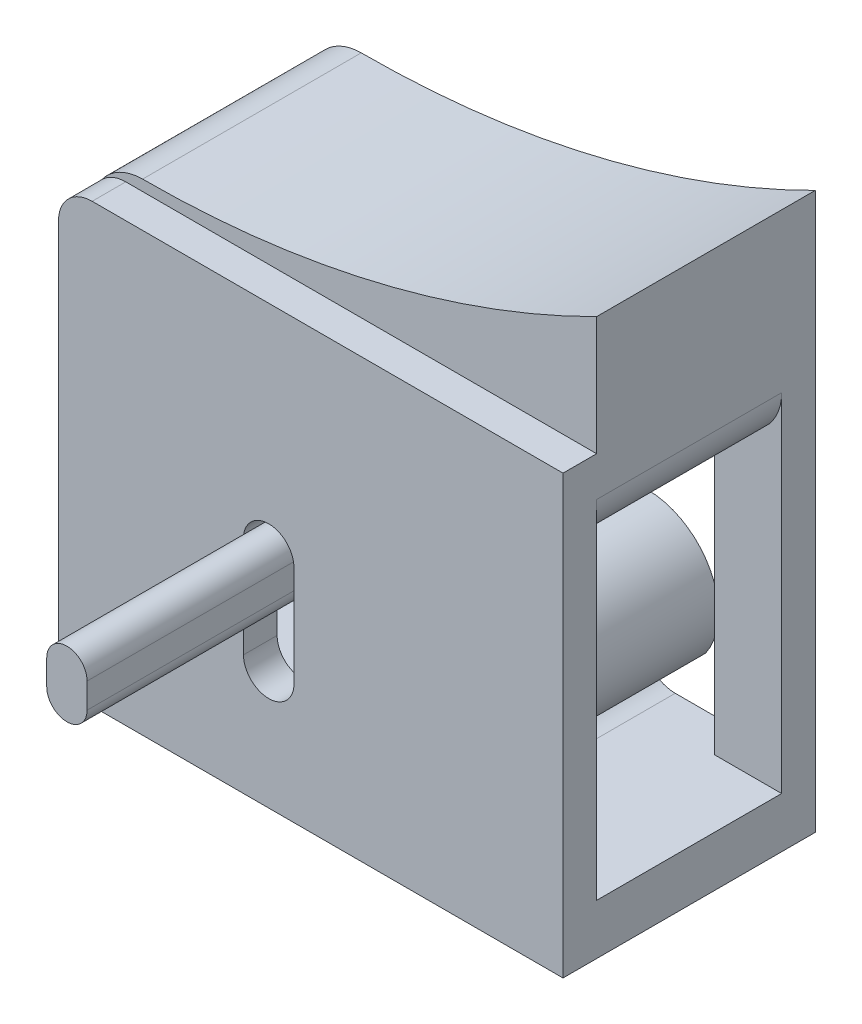
from build123d import *

# Parameters (mm, degrees)
RESSALTO_EXTRUS_O1_DEPTH   = 6
RESSALTO_EXTRUS_O1_2_DEPTH = 6
RESSALTO_EXTRUS_O2_START   = 1
RESSALTO_EXTRUS_O2_DEPTH   = 2
RESSALTO_EXTRUS_O4_START   = 1
ESBO_O3_W                  = 30
ESBO_O3_H                  = 3
RESSALTO_EXTRUS_O4_DEPTH   = 1
ESBO_O5_W                  = 4
ESBO_O5_H                  = 26
RESSALTO_EXTRUS_O6_DEPTH   = 2
RESSALTO_EXTRUS_O7_DEPTH   = 15
FILETE7_R                  = 2
FILETE8_R                  = 0.5
FILETE9_R                  = 2


with BuildPart() as part:
    # Esboço1 → Ressalto-extrusão1 (new, symmetric)
    with BuildSketch(Plane.XY):
        with BuildLine():
            Line((-9, -1.5), (9, -1.5))
            ThreePointArc((9, -1.5), (12, -4.5), (15, -1.5))
            Line((15, -1.5), (15, 1.5))
            Line((15, 1.5), (15, 7.918286702))
            ThreePointArc((15, 7.918286702), (1.876188275, 3.126620802), (-12, 1.5))
            ThreePointArc((-12, 1.5), (-14.121320344, 0.621320344), (-15, -1.5))
            ThreePointArc((-15, -1.5), (-12, -4.5), (-9, -1.5))
        make_face()
    extrude(amount=RESSALTO_EXTRUS_O1_DEPTH, both=True)



with BuildPart() as body_2:
    # Esboço1 → Ressalto-extrus_o1 2 (new, symmetric)
    with BuildSketch(Plane.XY):
        with BuildLine():
            Line((15, -25.142315596), (-15, -25.142315596))
            Line((-15, -25.142315596), (-15, -22.142315596))
            Line((-15, -22.142315596), (-3.5, -22.142315596))
            Line((-3.5, -22.142315596), (3.174548445, -22.142315596))
            Line((3.174548445, -22.142315596), (3.174548445, -16.732050808))
            Line((3.174548445, -16.732050808), (4.242268465, -16.732050808))
            ThreePointArc((4.242268465, -16.732050808), (5.462746803, -19.00323777), (7.90754076, -18.184189481))
            ThreePointArc((7.90754076, -18.184189481), (5.745986772, -13.568824016), (1.75, -16.732050808))
            ThreePointArc((1.75, -16.732050808), (-1, -19.482050808), (-3.75, -16.732050808))
            Line((-3.75, -16.732050808), (-3.75, -11))
            Line((-3.75, -11), (-0.75, -10))
            Line((-0.75, -10), (-0.75, -11))
            Line((-0.75, -11), (-0.75, -15))
            ThreePointArc((-0.75, -15), (-2.322875656, -17.877694731), (0.75, -16.732050808))
            ThreePointArc((0.75, -16.732050808), (6.283199983, -12.680397095), (8.475128378, -19.17867762))
            ThreePointArc((8.475128378, -19.17867762), (6.683061453, -20.158063602), (4.674548445, -19.788501348))
            Line((4.674548445, -19.788501348), (4.674548445, -22.142315596))
            Line((4.674548445, -22.142315596), (15, -22.142315596))
            Line((15, -22.142315596), (15, -25.142315596))
        make_face()
    extrude(amount=RESSALTO_EXTRUS_O1_2_DEPTH, both=True)


with BuildPart() as body_3:
    # Esboço2 → Ressalto-extrusão2 (new body)
    with BuildSketch(Plane.XY.offset(6).offset(RESSALTO_EXTRUS_O2_START)):
        with BuildLine():
            Line((-15, -25.142315596), (15, -25.142315596))
            Line((15, -25.142315596), (15, 0.857684404))
            Line((15, 0.857684404), (-13, 0.857684404))
            ThreePointArc((-13, 0.857684404), (-14.414213562, 0.271897966), (-15, -1.142315596))
            Line((-15, -1.142315596), (-15, -25.142315596))
        make_face()
        with BuildLine():
            Line((-1, -12), (-1, -18))
            ThreePointArc((-1, -18), (-2.5, -19.5), (-4, -18))
            Line((-4, -18), (-4, -12))
            ThreePointArc((-4, -12), (-2.5, -10.5), (-1, -12))
        make_face(mode=Mode.SUBTRACT)
    extrude(amount=RESSALTO_EXTRUS_O2_DEPTH)


with BuildPart() as part_1:
    add(part.part)

    add(body_2.part)  # Ressalto-extrusão4 merges body 2

    add(body_3.part)  # Ressalto-extrusão4 merges body 3
    # Esboço3 → Ressalto-extrusão4 (add)
    with BuildSketch(Plane.XY.offset(6).offset(RESSALTO_EXTRUS_O4_START)):
        with Locations((0, -23.642315596)):
            Rectangle(ESBO_O3_W, ESBO_O3_H)
        with BuildLine():
            Line((15, -1.5), (15, 7.918286702))
            ThreePointArc((15, 7.918286702), (1.876188275, 3.126620802), (-12, 1.5))
            ThreePointArc((-12, 1.5), (-14.121320344, -3.621320344), (-9, -1.5))
            Line((-9, -1.5), (9, -1.5))
            ThreePointArc((9, -1.5), (12, -4.5), (15, -1.5))
        make_face()
    extrude(amount=-RESSALTO_EXTRUS_O4_DEPTH)

    # Esboço5 → Ressalto-extrusão6 (add)
    with BuildSketch(Plane(origin=(0, 0, -6), x_dir=(-1, 0, 0), z_dir=(0, 0, -1))):
        with Locations((-13, -12.142315596)):
            Rectangle(ESBO_O5_W, ESBO_O5_H)
        with BuildLine():
            Line((6.25, -25.142315596), (6.25, 0.857684404))
            Line((6.25, 0.857684404), (12.25, 0.857684404))
            ThreePointArc((12.25, 0.857684404), (14.194543648, 0.052228052), (15, -1.892315596))
            Line((15, -1.892315596), (15, -25.142315596))
            Line((15, -25.142315596), (6.25, -25.142315596))
        make_face()
    extrude(amount=-RESSALTO_EXTRUS_O6_DEPTH)

    # Esboço4 → Ressalto-extrusão7 (add)
    with BuildSketch(Plane.XY.offset(6)):
        with BuildLine():
            Line((-1.3, -12), (-1.3, -13.5))
            ThreePointArc((-1.3, -13.5), (-2.5, -14.7), (-3.7, -13.5))
            Line((-3.7, -13.5), (-3.7, -12))
            ThreePointArc((-3.7, -12), (-2.5, -10.8), (-1.3, -12))
        make_face()
    extrude(amount=RESSALTO_EXTRUS_O7_DEPTH)

    # Filete7
    filete7_edges = [part_1.edges().sort_by_distance(p)[0] for p in [
        (4.674548445, -22.142315596, 0),
        (3.174548445, -22.142315596, 0),
    ]]
    fillet(filete7_edges, radius=FILETE7_R)

    # Filete8
    filete8_edges = [part_1.edges().sort_by_distance(p)[0] for p in [
        (4.242268465, -16.732050808, 0),
        (3.174548445, -16.732050808, 0),
    ]]
    fillet(filete8_edges, radius=FILETE8_R)

    # Filete9
    filete9_edges = [part_1.edges().sort_by_distance(p)[0] for p in [
        (-0.75, -15, 0),
    ]]
    fillet(filete9_edges, radius=FILETE9_R)


solid = part_1.part
